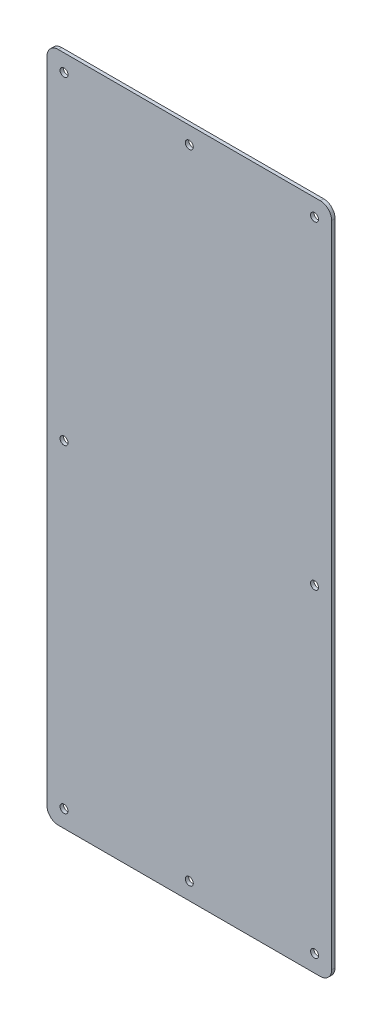
from build123d import *

# Parameters (mm, degrees)
SKETCH_1_W          = 250
SKETCH_1_H          = 590
EXTRUDE_1_DEPTH     = 3
FILLET_1_R          = 10
SKETCH_3_R          = 3.5
CUT_EXTRUDE_1_DEPTH = 3


with BuildPart() as part:
    # 草图1 → 凸台-拉伸1 (new body)
    with BuildSketch(Plane.XY):
        Rectangle(SKETCH_1_W, SKETCH_1_H)
    extrude(amount=EXTRUDE_1_DEPTH)

    # 圆角1
    fillet_1_edges = [part.edges().sort_by_distance(p)[0] for p in [
        (125, -295, 1.5),
        (-125, -295, 1.5),
        (-125, 295, 1.5),
        (125, 295, 1.5),
    ]]
    fillet(fillet_1_edges, radius=FILLET_1_R)

    # 草图3 → 切除-拉伸1 (cut)
    with BuildSketch(Plane.XY.offset(3)):
        with Locations((-110, 280)):
            Circle(SKETCH_3_R)
        with Locations((-110, -280)):
            Circle(SKETCH_3_R)
        with Locations((110, 280)):
            Circle(SKETCH_3_R)
        with Locations((110, -280)):
            Circle(SKETCH_3_R)
        with Locations((-110, 0)):
            Circle(SKETCH_3_R)
        with Locations((110, 0)):
            Circle(SKETCH_3_R)
        with Locations((0, 280)):
            Circle(SKETCH_3_R)
        with Locations((0, -280)):
            Circle(SKETCH_3_R)
    extrude(amount=-CUT_EXTRUDE_1_DEPTH, mode=Mode.SUBTRACT)


solid = part.part
